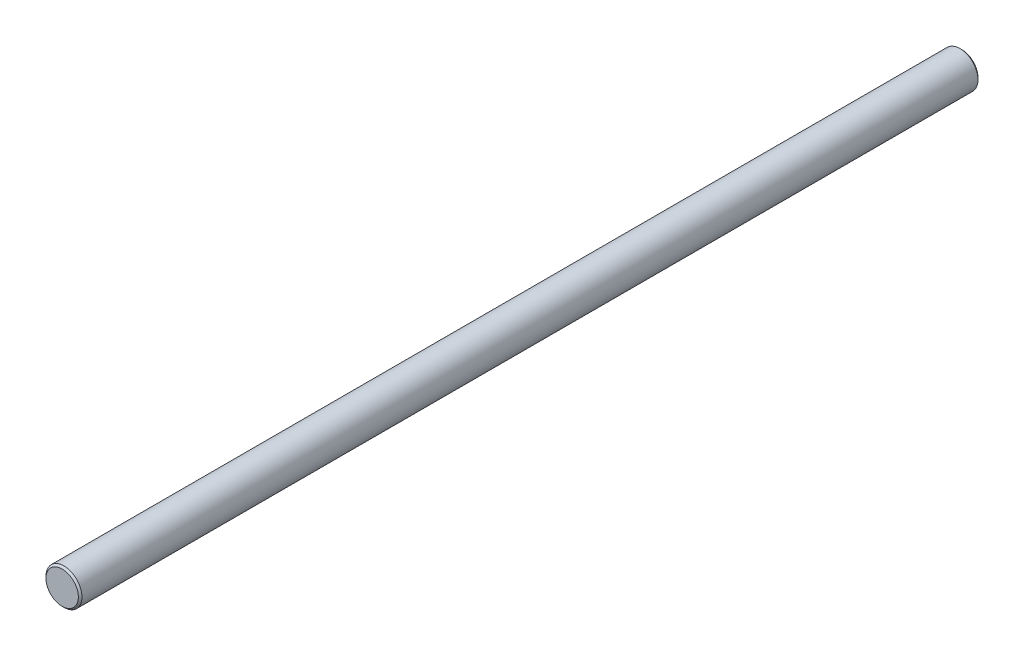
from build123d import *

# Parameters (mm, degrees)
SKETCH4_R           = 10
BOSS_EXTRUDE1_DEPTH = 250
CHAMFER1_SIZE       = 1


with BuildPart() as part:
    # Sketch4 → Boss-Extrude1 (new, symmetric)
    with BuildSketch(Plane.XY):
        Circle(SKETCH4_R)
    extrude(amount=BOSS_EXTRUDE1_DEPTH, both=True)

    # Chamfer1
    chamfer1_edges = [part.edges().sort_by_distance(p)[0] for p in [
        (-10, 0, -250),
        (-10, 0, 250),
    ]]
    chamfer(chamfer1_edges, length=CHAMFER1_SIZE)


solid = part.part
